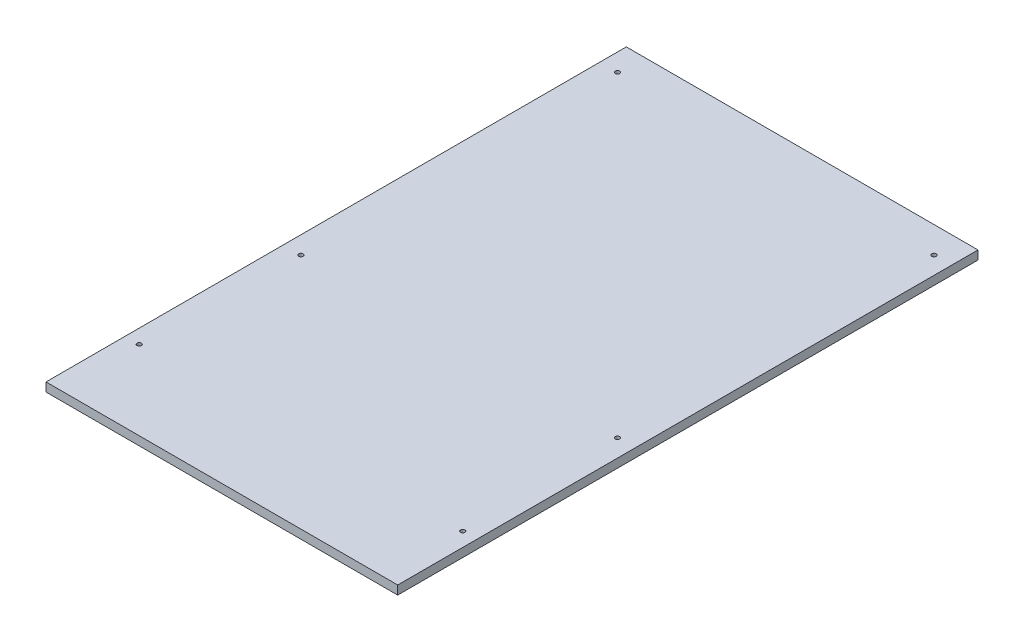
from build123d import *

# Parameters (mm, degrees)
SCHIZZO1_W                   = 200
SCHIZZO1_H                   = 330
ESTRUSIONE_ESTRUSIONE1_DEPTH = 5
FORO_FILETTATO_M3_1_D        = 2.5


with BuildPart() as part:
    # Schizzo1 → Estrusione-Estrusione1 (new body)
    with BuildSketch(Plane(origin=(0, 0, 0), x_dir=(1, 0, 0), z_dir=(0, 1, 0))):
        with Locations((0, 165)):
            Rectangle(SCHIZZO1_W, SCHIZZO1_H)
    extrude(amount=ESTRUSIONE_ESTRUSIONE1_DEPTH)

    # Foro filettato M3-1 (through all)
    with Locations(Plane(origin=(0, 5, 0), x_dir=(1, 0, 0), z_dir=(0, 1, 0))):
        with Locations((-92, 45), (92, 45), (-90, 134.977775034), (90, 134.977775034), (-90, 314.977775034), (90, 314.977775034)):
            Hole(FORO_FILETTATO_M3_1_D / 2)


solid = part.part
